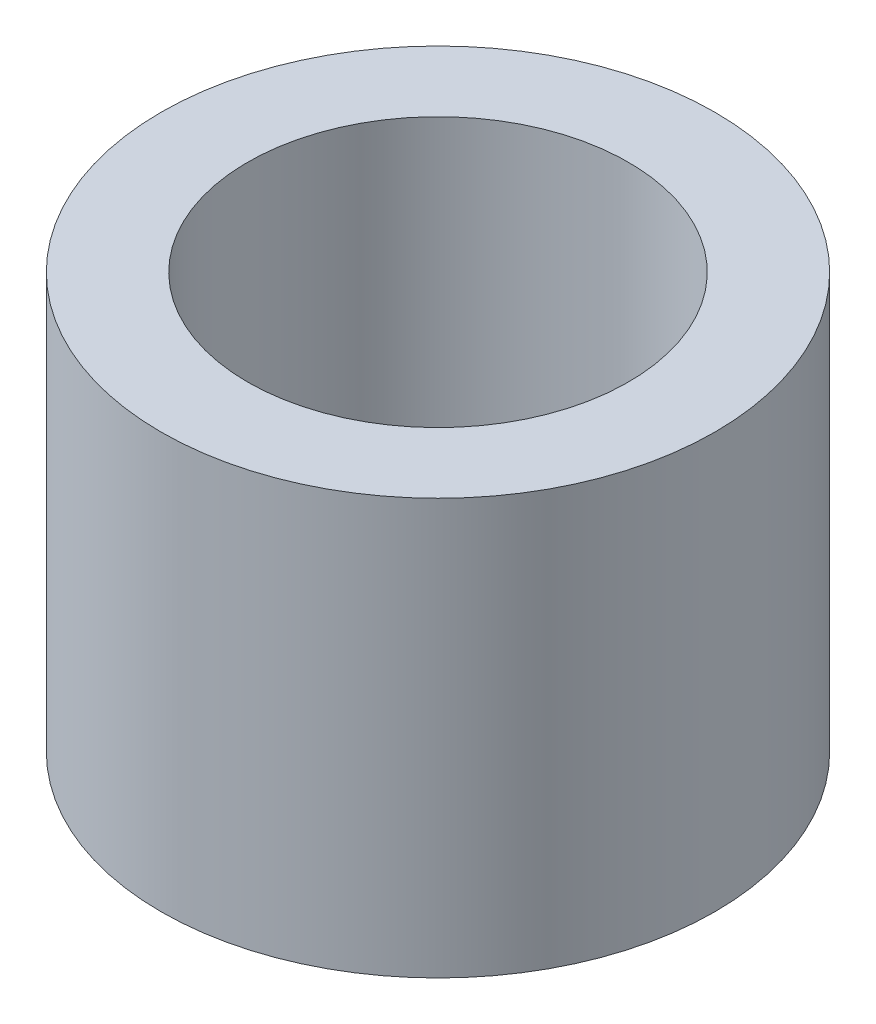
from build123d import *

# Parameters (mm, degrees)
SKETCH1_R           = 16
SKETCH1_R_2         = 11
BOSS_EXTRUDE1_DEPTH = 24


with BuildPart() as part:
    # Sketch1 → Boss-Extrude1 (new body)
    with BuildSketch(Plane(origin=(0, 0, 0), x_dir=(1, 0, 0), z_dir=(0, 1, 0))):
        with Locations(Location((0, 0, 0), (0, 0, 270))):
            Circle(SKETCH1_R)
        with Locations(Location((0, 0, 0), (0, 0, 270))):
            Circle(SKETCH1_R_2, mode=Mode.SUBTRACT)
    extrude(amount=BOSS_EXTRUDE1_DEPTH)


solid = part.part
